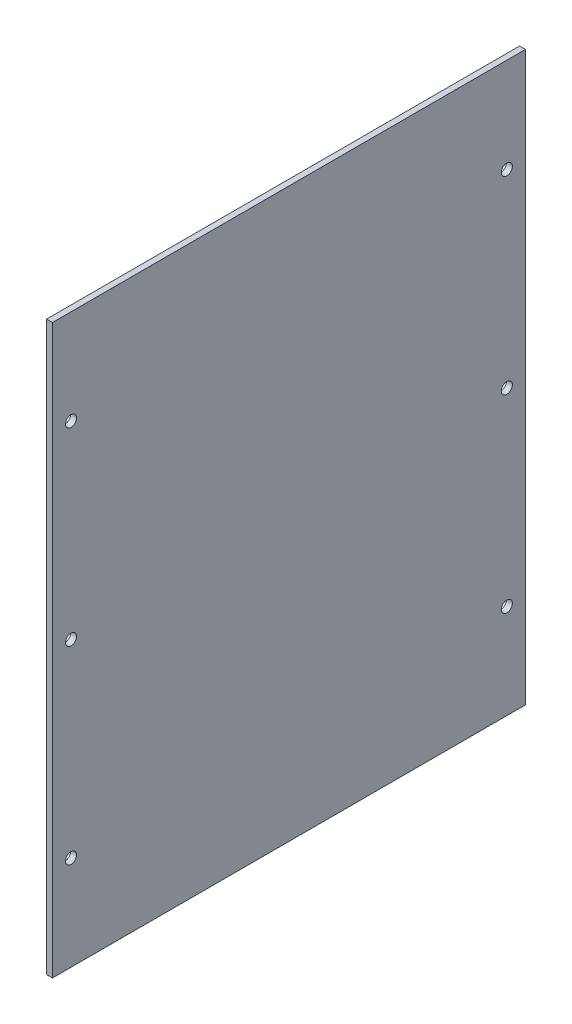
from build123d import *

# Parameters (mm, degrees)
SKETCH1_W           = 3.175
SKETCH1_H           = 254
BOSS_EXTRUDE1_DEPTH = 152.4
SKETCH2_R           = 2.9718
CUT_EXTRUDE1_DEPTH  = 3.175


with BuildPart() as part:
    # Sketch1 → Boss-Extrude1 (new, symmetric)
    with BuildSketch(Plane(origin=(0, 0, 0), x_dir=(1, 0, 0), z_dir=(0, 1, 0))):
        Rectangle(SKETCH1_W, SKETCH1_H)
    extrude(amount=BOSS_EXTRUDE1_DEPTH, both=True)

    # Sketch2 → Cut-Extrude1 (cut)
    with BuildSketch(Plane(origin=(1.5875, 0, 0), x_dir=(0, 0, -1), z_dir=(1, 0, 0))):
        with Locations((117, 0)):
            Circle(SKETCH2_R)
        with Locations((117, 101.6)):
            Circle(SKETCH2_R)
        with Locations(Location((117, -101.6, 0), (0, 0, 180))):
            Circle(SKETCH2_R)
        with Locations(Location((-117, 0, 0), (0, 0, 180))):
            Circle(SKETCH2_R)
        with Locations((-117, -101.6)):
            Circle(SKETCH2_R)
        with Locations(Location((-117, 101.6, 0), (0, 0, 180))):
            Circle(SKETCH2_R)
    extrude(amount=-CUT_EXTRUDE1_DEPTH, mode=Mode.SUBTRACT)


solid = part.part
